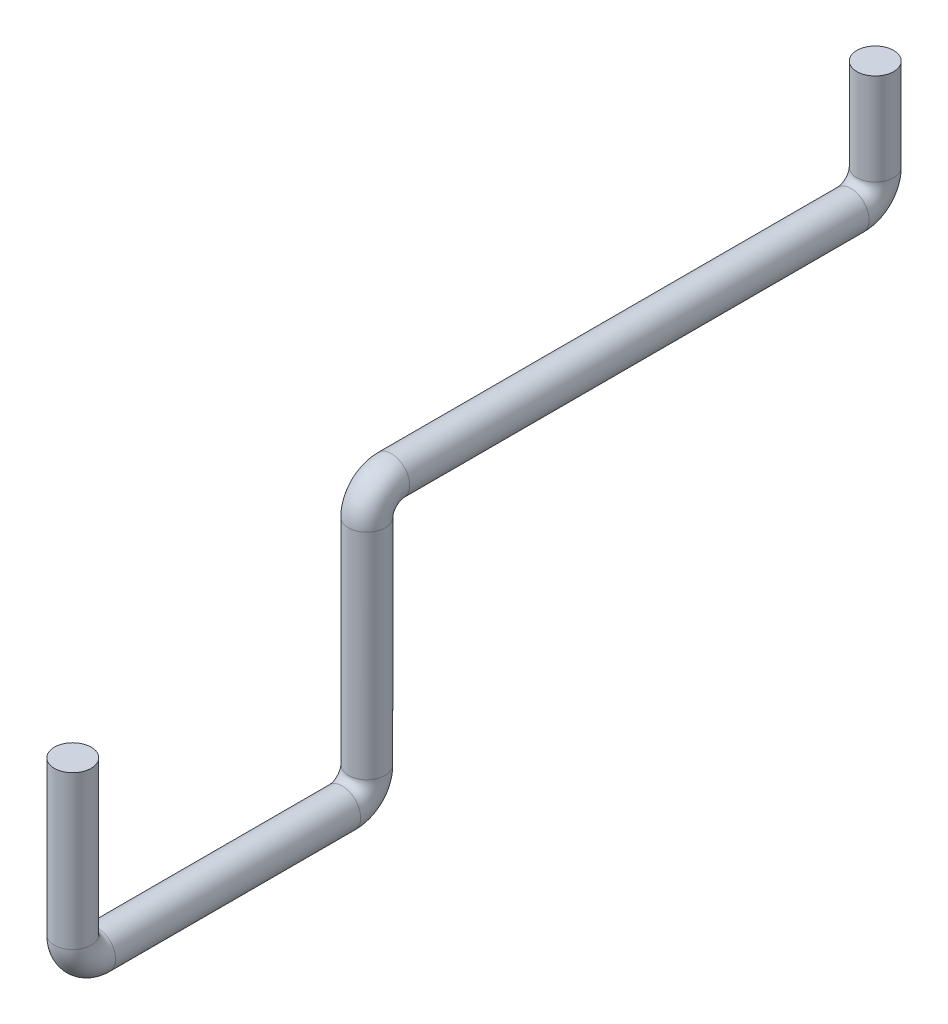
from build123d import *

# Parameters (mm, degrees)
SWEEP1_PROFILE_R = 0.6


with BuildPart() as part:
    # Sweep1: sweep along a path in Sketch1
    with BuildLine(Plane(origin=(0, 0, 0), x_dir=(0, 0, -1), z_dir=(1, 0, 0))) as sweep1_path:
        Line((0, 0), (0, -5))
        ThreePointArc((0, -5), (0.234314575, -5.565685425), (0.8, -5.8))
        Line((0.8, -5.8), (8.8, -5.8))
        ThreePointArc((8.8, -5.8), (9.365685425, -5.565685425), (9.6, -5))
        Line((9.6, -5), (9.6, 2))
        ThreePointArc((9.6, 2), (9.834314575, 2.565685425), (10.4, 2.8))
        Line((10.4, 2.8), (25.4, 2.8))
        ThreePointArc((25.4, 2.8), (25.965685425, 3.034314575), (26.2, 3.6))
        Line((26.2, 3.6), (26.2, 6.6))
    # Sweep1 profile (on start of the path) → Sweep1 (sweep)
    with BuildSketch(Plane(origin=(0, 0, 0), x_dir=(0, 0, -1), z_dir=(0, -1, 0))):
        Circle(SWEEP1_PROFILE_R)
    sweep(path=sweep1_path.line)


solid = part.part
